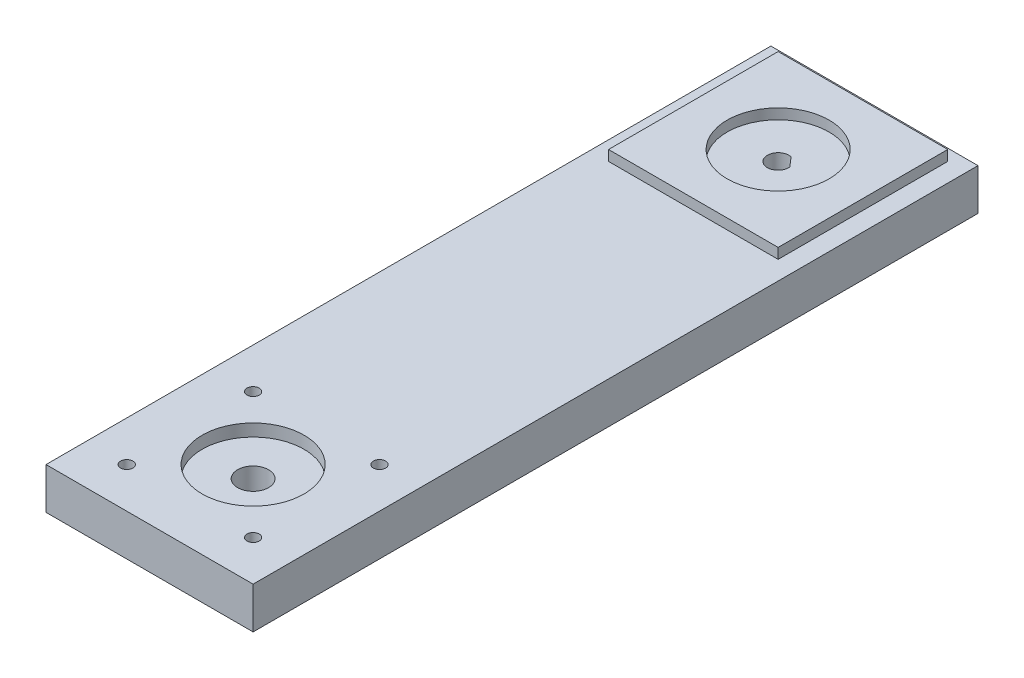
from build123d import *

# Parameters (mm, degrees)
SKETCH2_R           = 5.08
BOSS_EXTRUDE2_DEPTH = 41.91
SKETCH8_W           = 50.8
SKETCH8_H           = 177.8
BOSS_EXTRUDE3_DEPTH = 10.16
SKETCH11_W          = 41.599124914
SKETCH11_H          = 41.599124914
SKETCH11_R          = 12.5
BOSS_EXTRUDE6_DEPTH = 2.54
CUT_EXTRUDE1_DEPTH  = 25
SKETCH14_R          = 1.5
SKETCH14_R_2        = 3.81
CUT_EXTRUDE5_DEPTH  = 30.94
SKETCH18_R          = 12.5
CUT_EXTRUDE6_DEPTH  = 3
SKETCH19_W          = 42.604525883
SKETCH19_H          = 46.988260705
CUT_EXTRUDE7_DEPTH  = 85.804


with BuildPart() as part:
    # Sketch2 → Boss-Extrude2 (new body)
    with BuildSketch(Plane(origin=(0, 0, 0), x_dir=(-1, 0, 0), z_dir=(0, 1, 0))):
        with Locations(Location((0, 0, 0), (0, 0, 90))):
            Circle(SKETCH2_R)
    extrude(amount=BOSS_EXTRUDE2_DEPTH)

    # Sketch8 → Boss-Extrude3 (add)
    with BuildSketch(Plane(origin=(0, 41.91, 0), x_dir=(1, 0, 0), z_dir=(0, 1, 0))):
        with Locations((0, -65.27767655)):
            Rectangle(SKETCH8_W, SKETCH8_H)
    extrude(amount=BOSS_EXTRUDE3_DEPTH)

    # Sketch11 → Boss-Extrude6 (add)
    with BuildSketch(Plane(origin=(0, 52.07, 0), x_dir=(1, 0, 0), z_dir=(0, 1, 0))):
        Rectangle(SKETCH11_W, SKETCH11_H)
        with Locations(Location((0, 0, 0), (0, 0, 270))):
            Circle(SKETCH11_R, mode=Mode.SUBTRACT)
    extrude(amount=BOSS_EXTRUDE6_DEPTH)

    # Sketch12 → Cut-Extrude1 (cut)
    with BuildSketch(Plane(origin=(0, 52.07, 0), x_dir=(1, 0, 0), z_dir=(0, 1, 0))):
        with BuildLine():
            Line((2.628413525, 0.246153039), (0.602559077, 2.570227915))
            ThreePointArc((0.602559077, 2.570227915), (-2.068798379, -1.639884826), (2.639914577, 0))
            ThreePointArc((2.639914577, 0), (2.637037747, 0.123210788), (2.628413525, 0.246153039))
        make_face()
    extrude(amount=-CUT_EXTRUDE1_DEPTH, mode=Mode.SUBTRACT)

    # Sketch14 → Cut-Extrude5 (cut)
    with BuildSketch(Plane.XZ.offset(-41.91)):
        with Locations(Location((15.5, 144.27767655, 0), (0, 0, 270))):
            Circle(SKETCH14_R)
        with Locations(Location((0, 128.77767655, 0), (0, 0, 270))):
            Circle(SKETCH14_R_2)
        with Locations(Location((-15.5, 113.27767655, 0), (0, 0, 270))):
            Circle(SKETCH14_R)
        with Locations(Location((15.5, 113.27767655, 0), (0, 0, 270))):
            Circle(SKETCH14_R)
        with Locations(Location((-15.5, 144.27767655, 0), (0, 0, 270))):
            Circle(SKETCH14_R)
    extrude(amount=-CUT_EXTRUDE5_DEPTH, mode=Mode.SUBTRACT)

    # Sketch18 → Cut-Extrude6 (cut)
    with BuildSketch(Plane(origin=(0, 52.07, 0), x_dir=(1, 0, 0), z_dir=(0, 1, 0))):
        with Locations(Location((0, -128.77767655, 0), (0, 0, 270))):
            Circle(SKETCH18_R)
    extrude(amount=-CUT_EXTRUDE6_DEPTH, mode=Mode.SUBTRACT)

    # Sketch19 → Cut-Extrude7 (cut)
    with BuildSketch(Plane.ZY.offset(25.4)):
        with Locations((-1.112784187, 18.415869648)):
            Rectangle(SKETCH19_W, SKETCH19_H)
    extrude(amount=-CUT_EXTRUDE7_DEPTH, mode=Mode.SUBTRACT)


solid = part.part
